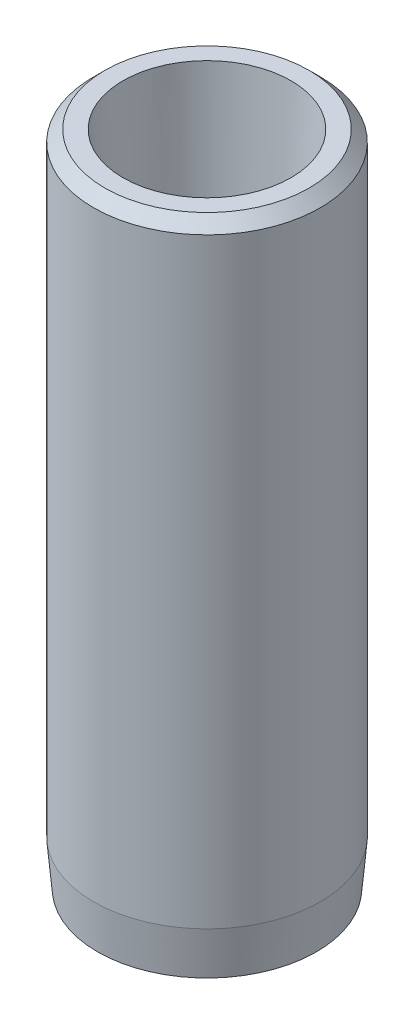
from build123d import *

# Parameters (mm, degrees)
SKETCH1_R           = 5
SKETCH1_R_2         = 2.5
BOSS_EXTRUDE1_DEPTH = 29
CHAMFER1_SIZE       = 2
CHAMFER1_SIZE2      = 0.174977327
CHAMFER2_SIZE       = 0.5


with BuildPart() as part:
    # Sketch1 → Boss-Extrude1 (new body)
    with BuildSketch(Plane(origin=(0, 0, 0), x_dir=(1, 0, 0), z_dir=(0, 1, 0))):
        with Locations(Location((0, 0, 0), (0, 0, 90))):
            Circle(SKETCH1_R)
        with Locations(Location((0, 0, 0), (0, 0, 90))):
            Circle(SKETCH1_R_2, mode=Mode.SUBTRACT)
    extrude(amount=BOSS_EXTRUDE1_DEPTH)

    # Cut-Sweep1: sweep along a curve in space
    with BuildLine() as cut_sweep1_path:
        ThreePointArc((0, 29, 2.5), (1.767766953, 29, 1.767766953), (2.5, 29, 0))
        ThreePointArc((2.5, 29, 0), (1.767766953, 29, -1.767766953), (0, 29, -2.5))
        ThreePointArc((0, 29, -2.5), (-1.767766953, 29, -1.767766953), (-2.5, 29, 0))
        ThreePointArc((-2.5, 29, 0), (-1.767766953, 29, 1.767766953), (0, 29, 2.5))
    # Sketch2 → Cut-Sweep1 (sweep, cut)
    with BuildSketch(Plane.XY):
        Polygon((2.5, 6), (3.705378924, 29), (2.5, 29), align=None)
    sweep(path=cut_sweep1_path.line, mode=Mode.SUBTRACT)

    # Chamfer1
    chamfer1_edges = [part.edges().sort_by_distance(p)[0] for p in [
        (0, 0, 5),
    ]]
    chamfer1_side = [part.faces().sort_by_distance(p)[0] for p in [
        (0, 14.5, 5),
    ]]
    chamfer(chamfer1_edges, length=CHAMFER1_SIZE, length2=CHAMFER1_SIZE2, reference=chamfer1_side[0])

    # Chamfer2
    chamfer2_edges = [part.edges().sort_by_distance(p)[0] for p in [
        (0, 29, 5),
    ]]
    chamfer(chamfer2_edges, length=CHAMFER2_SIZE)


solid = part.part
